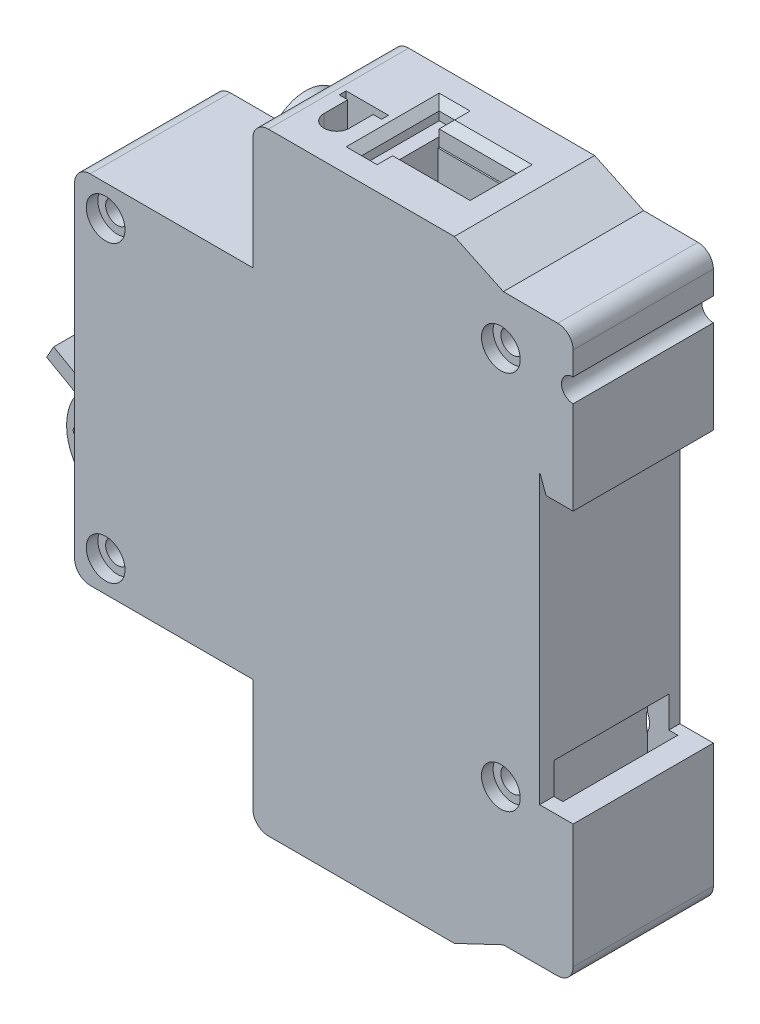
from build123d import *

# Parameters (mm, degrees)
EXTRUDE1_DEPTH      = 18.1
CUT_EXTRUDE2_DEPTH  = 88.93328712
CHAMFER1_SIZE       = 1
CHAMFER5_SIZE       = 1
CHAMFER6_SIZE       = 1
SKETCH5_R           = 5.25
EXTRUDE4_DEPTH      = 2.5
CHAMFER7_SIZE       = 1
CHAMFER8_SIZE       = 1
SKETCH16_R          = 3.5
EXTRUDE5_DEPTH      = 14
SKETCH17_W          = 6.321699236
SKETCH17_H          = 2.498507094
SKETCH17_W_2        = 5.569881947
SKETCH17_H_2        = 3.348246735
EXTRUDE6_DEPTH      = 2
EXTRUDE7_START      = -2
EXTRUDE7_DEPTH      = 2
EXTRUDE8_START      = -2
EXTRUDE8_DEPTH      = 2
SKETCH22_W          = 9.49098022
SKETCH22_H          = 11.929401444
EXTRUDE9_DEPTH      = 10
CHAMFER9_SIZE       = 1
FILLET2_R           = 2
SKETCH26_W          = 3.933053785
SKETCH26_H          = 14.830958186
EXTRUDE11_DEPTH     = 22
SKETCH27_R          = 0.5
EXTRUDE12_DEPTH     = 73.436180815
SKETCH28_R          = 0.5
EXTRUDE13_DEPTH     = 74.141567749
SKETCH29_R          = 1.5
EXTRUDE14_DEPTH     = 74.607668981
SKETCH30_R          = 2.5
EXTRUDE15_DEPTH     = 1.5
EXTRUDE16_START     = -1.5
SKETCH31_R          = 2.5
EXTRUDE16_DEPTH     = 1.5
EXTRUDE_THIN1_START = -3
EXTRUDE_THIN1_DEPTH = 72
EXTRUDE17_START     = -2
SKETCH33_W          = 1.780336453
SKETCH33_H          = 9.747441257
EXTRUDE17_DEPTH     = 74
SKETCH34_R          = 3.264159846
SKETCH34_R_2        = 3.109134691
EXTRUDE19_DEPTH     = 10
EXTRUDE20_DEPTH     = 3
SKETCH36_R          = 6.172750101
EXTRUDE21_DEPTH     = 9.2
EXTRUDE22_START     = -2
EXTRUDE22_DEPTH     = 9
EXTRUDE23_DEPTH     = 8
EXTRUDE24_START     = -30
SKETCH39_W          = 10.007252031
SKETCH39_H          = 5.47022562
EXTRUDE24_DEPTH     = 10


with BuildPart() as part:
    # Sketch1 → Extrude1 (new body)
    with BuildSketch(Plane.XY):
        with BuildLine():
            Line((-34.112358226, 44.412095776), (-34.112358226, 21.412095776))
            Line((-34.112358226, 21.412095776), (25.887641774, 21.412095776))
            Line((25.887641774, 21.412095776), (25.887641774, 39.912095776))
            Line((25.887641774, 39.912095776), (25.98420693, 39.912095776))
            Line((25.98420693, 39.912095776), (26.712124935, 37.876056127))
            Line((26.712124935, 37.876056127), (30.212124935, 37.876056127))
            Line((30.212124935, 37.876056127), (30.212124935, 49.876056127))
            ThreePointArc((30.212124935, 49.876056127), (28.712124935, 51.376056127), (30.212124935, 52.876056127))
            Line((30.212124935, 52.876056127), (30.212124935, 57.876056127))
            Line((30.212124935, 57.876056127), (21.212197094, 57.912095776))
            Line((21.212197094, 57.912095776), (14.887641774, 60.912095776))
            Line((14.887641774, 60.912095776), (-11.112358226, 60.912095776))
            Line((-11.112358226, 60.912095776), (-11.112358226, 44.412095776))
            Line((-11.112358226, 44.412095776), (-34.112358226, 44.412095776))
        make_face()
        Polygon((25.887641774, 21.412095776), (-34.112358226, 21.412095776), (-34.112358226, -1.587904224), (-11.112358226, -1.587904224), (-11.112358226, -18.087904224), (14.887641774, -18.087904224), (21.212197094, -15.087904224), (30.212124935, -15.051864574), (30.212124935, 2.912095776), (25.887641774, 2.912095776), align=None)
    extrude(amount=EXTRUDE1_DEPTH)

    # Sketch3 → Cut-Extrude2 (cut, through all)
    with BuildSketch(Plane(origin=(0, 60.912095776, 0), x_dir=(1, 0, 0), z_dir=(0, 1, 0))):
        Polygon((-1.112358226, -4.062549419), (0.887641774, -4.062549419), (0.887641774, -6.062549419), (10.887641774, -6.062549419), (10.887641774, -12.062549419), (0.887641774, -12.062549419), (0.887641774, -14.062549419), (-1.112358226, -14.062549419), align=None)
    extrude(amount=-CUT_EXTRUDE2_DEPTH, mode=Mode.SUBTRACT)

    # Chamfer1
    chamfer1_edges = [part.edges().sort_by_distance(p)[0] for p in [
        (-1.112358226, 60.912095776, 9.062549419),
        (-0.112358226, 60.912095776, 14.062549419),
        (-0.112358226, 60.912095776, 4.062549419),
    ]]
    chamfer(chamfer1_edges, length=CHAMFER1_SIZE)

    # Chamfer5
    chamfer5_edges = [part.edges().sort_by_distance(p)[0] for p in [
        (5.887641774, 60.912095776, 12.062549419),
    ]]
    chamfer(chamfer5_edges, length=CHAMFER5_SIZE)

    # Chamfer6
    chamfer6_edges = [part.edges().sort_by_distance(p)[0] for p in [
        (0.887641774, -18.087904224, 13.062549419),
        (5.887641774, -18.087904224, 12.062549419),
        (10.887641774, -18.087904224, 9.062549419),
        (5.887641774, -18.087904224, 6.062549419),
        (0.887641774, -18.087904224, 5.062549419),
        (0.887641774, 60.912095776, 14.062549419),
        (0.887641774, 60.912095776, 4.562549419),
        (5.887641774, 60.912095776, 6.062549419),
        (10.887641774, 60.912095776, 9.562549419),
    ]]
    chamfer(chamfer6_edges, length=CHAMFER6_SIZE)

    # Sketch5 → Extrude4 (add)
    with BuildSketch(Plane.ZY.offset(11.112358226)):
        with Locations(Location((8.75, -9.961720866, 0), (0, 0, 90))):
            Circle(SKETCH5_R)
        with Locations(Location((8.78441822, 53.038269732, 0), (0, 0, 270))):
            Circle(SKETCH5_R)
    extrude(amount=EXTRUDE4_DEPTH)

    # Chamfer7
    chamfer7_edges = [part.edges().sort_by_distance(p)[0] for p in [
        (-1.112358226, -18.087904224, 9.062549419),
    ]]
    chamfer(chamfer7_edges, length=CHAMFER7_SIZE)

    # Chamfer8
    chamfer8_edges = [part.edges().sort_by_distance(p)[0] for p in [
        (-0.112358226, -18.087904224, 14.062549419),
        (-0.112358226, -18.087904224, 4.062549419),
    ]]
    chamfer(chamfer8_edges, length=CHAMFER8_SIZE)

    # Sketch16 → Extrude5 (cut)
    with BuildSketch(Plane.ZY.offset(13.612358226)):
        with Locations(Location((8.75, -9.961720866, 0), (0, 0, 270))):
            Circle(SKETCH16_R)
        with Locations(Location((8.78441822, 53.038269732, 0), (0, 0, 270))):
            Circle(SKETCH16_R)
    extrude(amount=-EXTRUDE5_DEPTH, mode=Mode.SUBTRACT)

    # Sketch17 → Extrude6 (add)
    with BuildSketch(Plane.ZY.offset(11.112358226)):
        with Locations((8.75, 45.703248492)):
            Rectangle(SKETCH17_W, SKETCH17_H)
        with Locations((8.565929258, -2.256527569)):
            Rectangle(SKETCH17_W_2, SKETCH17_H_2)
    extrude(amount=EXTRUDE6_DEPTH)

    # Sketch22 → Extrude9 (cut)
    with BuildSketch(Plane.ZY.offset(34.112358226)):
        with Locations((9.05, 12.847287698)):
            Rectangle(SKETCH22_W, SKETCH22_H)
    extrude(amount=-EXTRUDE9_DEPTH, mode=Mode.SUBTRACT)

    # Chamfer9
    chamfer9_edges = [part.edges().sort_by_distance(p)[0] for p in [
        (-34.112358226, 6.882586976, 9.05),
        (-34.112358226, 18.81198842, 9.05),
    ]]
    chamfer(chamfer9_edges, length=CHAMFER9_SIZE)

    # Fillet2
    fillet2_edges = [part.edges().sort_by_distance(p)[0] for p in [
        (-34.112358226, 44.412095776, 9.05),
        (-11.112358226, 60.912095776, 9.05),
        (30.212124935, 57.876056127, 9.05),
        (30.212124935, -15.051864574, 9.05),
        (-11.112358226, -18.087904224, 9.05),
        (-34.112358226, -1.587904224, 9.05),
    ]]
    fillet(fillet2_edges, radius=FILLET2_R)

    # Sketch26 → Extrude11 (cut)
    with BuildSketch(Plane(origin=(0.060757745, -15.172603843, 0), x_dir=(0.9999919823361872, 0.0040044054917793975, 0), z_dir=(0.0040044054917793975, -0.9999919823361874, 0))):
        with Locations((25.089373257, 8.837141923)):
            Rectangle(SKETCH26_W, SKETCH26_H)
    extrude(amount=-EXTRUDE11_DEPTH, mode=Mode.SUBTRACT)

    # Sketch27 → Extrude12 (cut, through all)
    with BuildSketch(Plane(origin=(0, 0, 5.589150382), x_dir=(-1, 0, 0), z_dir=(0, 0, -1))):
        with Locations((12.112358226, 45.703248492)):
            Circle(SKETCH27_R)
        with Locations((12.112358226, -2.369060481)):
            Circle(SKETCH27_R)
    extrude(amount=-EXTRUDE12_DEPTH, mode=Mode.SUBTRACT)

    # Sketch29 → Extrude14 (cut, through all)
    with BuildSketch(Plane.XY.offset(18.1)):
        with Locations((-30.112358226, 40.412095776)):
            Circle(SKETCH29_R)
        with Locations((20.887641774, 51.412095776)):
            Circle(SKETCH29_R)
        with Locations((20.887641774, 2.412095776)):
            Circle(SKETCH29_R)
        with Locations((-30.112358226, 2.412095776)):
            Circle(SKETCH29_R)
    extrude(amount=-EXTRUDE14_DEPTH, mode=Mode.SUBTRACT)

    # Sketch30 → Extrude15 (cut)
    with BuildSketch(Plane.XY.offset(18.1)):
        with Locations((-30.112358226, 2.412095776)):
            Circle(SKETCH30_R)
        with Locations((-30.112358226, 40.412095776)):
            Circle(SKETCH30_R)
        with Locations((20.887641774, 2.412095776)):
            Circle(SKETCH30_R)
        with Locations((20.887641774, 51.412095776)):
            Circle(SKETCH30_R)
    extrude(amount=-EXTRUDE15_DEPTH, mode=Mode.SUBTRACT)

    # Sketch31 → Extrude16 (cut)
    with BuildSketch(Plane(origin=(0, 0, 0), x_dir=(-1, 0, 0), z_dir=(0, 0, -1)).offset(EXTRUDE16_START)):
        with Locations(Location((30.112358226, 40.412095776, 0), (0, 0, 180))):
            Circle(SKETCH31_R)
        with Locations(Location((30.112358226, 2.412095776, 0), (0, 0, 180))):
            Circle(SKETCH31_R)
        with Locations(Location((-20.887641774, 51.412095776, 0), (0, 0, 180))):
            Circle(SKETCH31_R)
        with Locations(Location((-20.887641774, 2.412095776, 0), (0, 0, 180))):
            Circle(SKETCH31_R)
    extrude(amount=EXTRUDE16_DEPTH, mode=Mode.SUBTRACT)

    # Sketch32 → Extrude-Thin1 (add)
    with BuildSketch(Plane(origin=(0, 60.912095776, 0), x_dir=(1, 0, 0), z_dir=(0, 1, 0)).offset(EXTRUDE_THIN1_START)):
        Polygon((0.943532874, -11.803926621), (10.769257085, -11.803926621), (10.769257085, -6.267694806), (0.943532874, -6.267694806), (0.943532874, -5.267694806), (11.769257085, -5.267694806), (11.769257085, -12.803926621), (0.943532874, -12.803926621), align=None)
    extrude(amount=-EXTRUDE_THIN1_DEPTH)

    # Sketch36 → Extrude21 (add)
    with BuildSketch(Plane(origin=(0, 0, 13.79549011), x_dir=(-1, 0, 0), z_dir=(0, 0, -1))):
        with Locations((28.917484044, 12.630152158)):
            Circle(SKETCH36_R)
    extrude(amount=EXTRUDE21_DEPTH)



with BuildPart() as body_2:
    # Sketch19 → Extrude7 (new body)
    with BuildSketch(Plane(origin=(0, 0, 0), x_dir=(-1, 0, 0), z_dir=(0, 0, -1)).offset(EXTRUDE7_START)):
        with BuildLine():
            Line((34.112358226, 7.02503036), (34.112358226, 18.589449607))
            ThreePointArc((34.112358226, 18.589449607), (37.150982773, 12.807239984), (34.112358226, 7.02503036))
        make_face()
    extrude(amount=-EXTRUDE7_DEPTH)


with BuildPart() as body_3:
    # Sketch21 → Extrude8 (new body)
    with BuildSketch(Plane.XY.offset(18.1).offset(EXTRUDE8_START)):
        with BuildLine():
            Line((-34.112358226, 7.02503036), (-34.112358226, 18.589449607))
            ThreePointArc((-34.112358226, 18.589449607), (-37.150982773, 12.807239984), (-34.112358226, 7.02503036))
        make_face()
    extrude(amount=-EXTRUDE8_DEPTH)


with BuildPart() as extrude13_tool:
    # Sketch28 → Extrude13 (new, through all)
    with BuildSketch(Plane(origin=(0, 0, 2), x_dir=(-1, 0, 0), z_dir=(0, 0, -1))):
        with Locations((35.802696234, 12.670510636)):
            Circle(SKETCH28_R)
    extrude(amount=-EXTRUDE13_DEPTH)


with BuildPart() as body_2_1:
    add(body_2.part)

    # Extrude13: cut by extrude13_tool
    add(extrude13_tool.part, mode=Mode.SUBTRACT)


with BuildPart() as body_3_1:
    add(body_3.part)

    # Extrude13: cut by extrude13_tool
    add(extrude13_tool.part, mode=Mode.SUBTRACT)


with BuildPart() as body_4:
    # Sketch33 → Extrude17 (new body)
    with BuildSketch(Plane(origin=(0, 60.912095776, 0), x_dir=(1, 0, 0), z_dir=(0, 1, 0)).offset(EXTRUDE17_START)):
        with Locations((-0.128163172, -9.022064178)):
            Rectangle(SKETCH33_W, SKETCH33_H)
    extrude(amount=-EXTRUDE17_DEPTH)

    # Sketch34 → Extrude19 (add)
    with BuildSketch(Plane.ZY.offset(1.018331399)):
        with Locations(Location((8.78441822, 53.038269732, 0), (0, 0, 270))):
            Circle(SKETCH34_R)
        with Locations(Location((8.75, -9.961720866, 0), (0, 0, 270))):
            Circle(SKETCH34_R_2)
    extrude(amount=EXTRUDE19_DEPTH)

    # Sketch35 → Extrude20 (cut)
    with BuildSketch(Plane.ZY.offset(11.018331399)):
        Polygon((9.303382256, -10.587224428), (9.303382256, -12.544717649), (8.196617744, -12.544717649), (8.196617744, -10.587224428), (6.073945132, -10.587224428), (6.073945132, -9.336217304), (8.196617744, -9.336217304), (8.196617744, -7.378724082), (9.303382256, -7.378724082), (9.303382256, -9.336217304), (11.426054868, -9.336217304), (11.426054868, -10.587224428), align=None)
        Polygon((9.16642449, 55.891354464), (8.40241195, 55.891354464), (8.40241195, 53.391964717), (6.142781572, 53.391964717), (6.142781572, 52.684574747), (8.40241195, 52.684574747), (8.40241195, 50.185185), (9.16642449, 50.185185), (9.16642449, 52.684574747), (11.426054868, 52.684574747), (11.426054868, 53.391964717), (9.16642449, 53.391964717), align=None)
    extrude(amount=-EXTRUDE20_DEPTH, mode=Mode.SUBTRACT)


with BuildPart() as part_1:
    add(part.part)

    add(body_3_1.part)  # Extrude22 merges body 3
    # Sketch37 → Extrude22 (add)
    with BuildSketch(Plane.XY.offset(16.1).offset(EXTRUDE22_START)):
        Polygon((-34.643879985, 13.112860794), (-41.725467749, 17.115624896), (-40.818239677, 18.720669572), (-33.736651913, 14.71790547), align=None)
    extrude(amount=-EXTRUDE22_DEPTH)

    # Sketch38 → Extrude23 (cut)
    with BuildSketch(Plane(origin=(0, 60.912095776, 0), x_dir=(1, 0, 0), z_dir=(0, 1, 0))):
        with BuildLine():
            Line((-8.36283271, -8.81042867), (-2.905862724, -8.81042867))
            Line((-2.905862724, -8.81042867), (-2.905862724, -9.705013914))
            Line((-2.905862724, -9.705013914), (-3.979365017, -9.705013914))
            Line((-3.979365017, -9.705013914), (-3.979365017, -12.746603742))
            ThreePointArc((-3.979365017, -12.746603742), (-5.621572303, -14.419197345), (-7.263779589, -12.746603742))
            Line((-7.263779589, -12.746603742), (-7.263779589, -9.705013914))
            Line((-7.263779589, -9.705013914), (-8.36283271, -9.705013914))
            Line((-8.36283271, -9.705013914), (-8.36283271, -8.81042867))
        make_face()
    extrude(amount=-EXTRUDE23_DEPTH, mode=Mode.SUBTRACT)


    add(body_4.part)  # Extrude24 merges body 4
    # Sketch39 → Extrude24 (add)
    with BuildSketch(Plane(origin=(0, 44.412095776, 0), x_dir=(-1, 0, 0), z_dir=(0, 1, 0)).offset(EXTRUDE24_START)):
        with Locations((-5.76563107, 9.068813811)):
            Rectangle(SKETCH39_W, SKETCH39_H)
    extrude(amount=EXTRUDE24_DEPTH)


solid = Compound([body_2_1.part, part_1.part])
